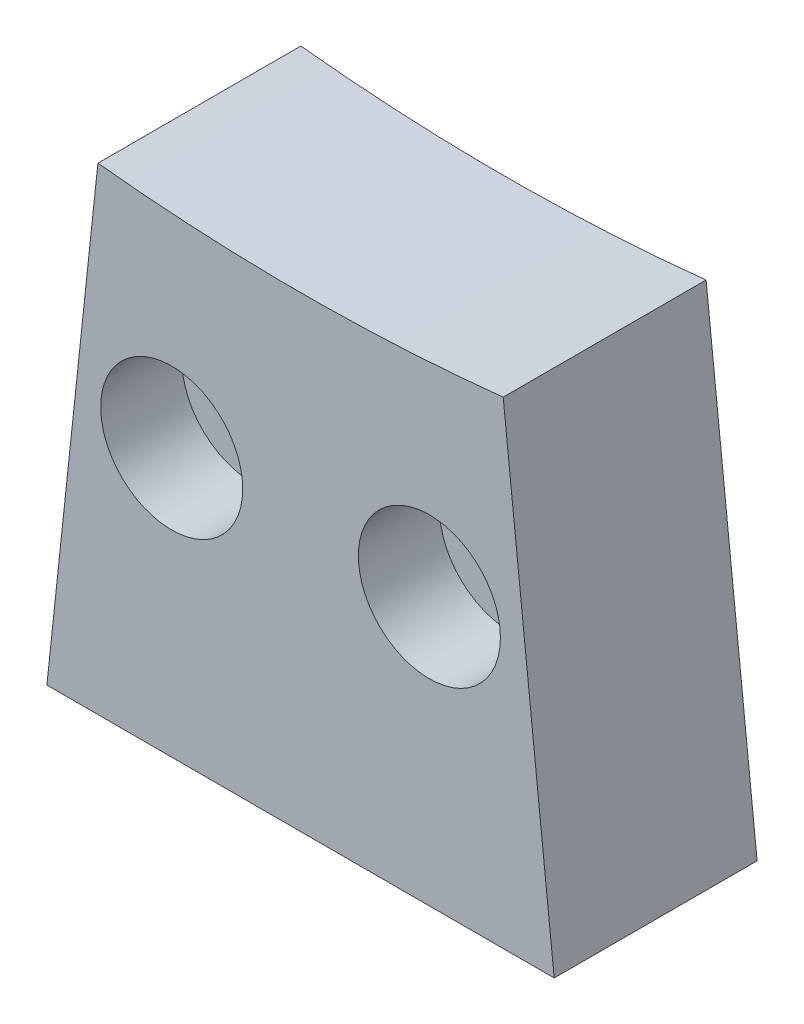
from build123d import *

# Parameters (mm, degrees)
BOSS_EXTRU_1_DEPTH      = 10
ESQUISSE2_R             = 1.025
ENL_V_MAT_EXTRU_1_DEPTH = 8
ENL_V_MAT_EXTRU_2_REACH = 120.09
ESQUISSE3_R             = 1.75
ESQUISSE4_R             = 3.5
ESQUISSE4_R_2           = 1.75
ENL_V_MAT_EXTRU_3_DEPTH = 4


with BuildPart() as part:
    # Esquisse1 → Boss.-Extru.1 (new body)
    with BuildSketch(Plane.XY):
        with BuildLine():
            Line((-12.5, -117), (12.5, -117))
            Line((12.5, -117), (9.985905815, -93.468078428))
            ThreePointArc((9.985905815, -93.468078428), (0, -94), (-9.985905815, -93.468078428))
            Line((-9.985905815, -93.468078428), (-12.5, -117))
        make_face()
    extrude(amount=BOSS_EXTRU_1_DEPTH)

    # Esquisse2 → Enlèv. mat.-Extru.1 (cut)
    with BuildSketch(Plane.XZ.offset(117)):
        with Locations((-4.75, 6)):
            Circle(ESQUISSE2_R)
        with Locations((4.75, 6)):
            Circle(ESQUISSE2_R)
    extrude(amount=-ENL_V_MAT_EXTRU_1_DEPTH, mode=Mode.SUBTRACT)

    # Esquisse3 → Enlèv. mat.-Extru.2 (cut, up to next)
    with BuildSketch(Plane.XY.offset(10), mode=Mode.PRIVATE) as enl_v_mat_extru_2_sk1:
        with Locations((-6.349048112, -103.806019036)):
            Circle(ESQUISSE3_R)
    enl_v_mat_extru_2_tool1 = extrude(enl_v_mat_extru_2_sk1.sketch, amount=-ENL_V_MAT_EXTRU_2_REACH, mode=Mode.PRIVATE) & part.part
    # Esquisse3 → Enlèv. mat.-Extru.2 (cut, up to next)
    with BuildSketch(Plane.XY.offset(10), mode=Mode.PRIVATE) as enl_v_mat_extru_2_sk2:
        with Locations((6.349048112, -103.806019036)):
            Circle(ESQUISSE3_R)
    enl_v_mat_extru_2_tool2 = extrude(enl_v_mat_extru_2_sk2.sketch, amount=-ENL_V_MAT_EXTRU_2_REACH, mode=Mode.PRIVATE) & part.part
    add(enl_v_mat_extru_2_tool1.solids().sort_by_distance((-6.349048, -103.806019, 10))[0], mode=Mode.SUBTRACT)
    add(enl_v_mat_extru_2_tool2.solids().sort_by_distance((6.349048, -103.806019, 10))[0], mode=Mode.SUBTRACT)

    # Esquisse4 → Enlèv. mat.-Extru.3 (cut)
    # profile 1 of 2: a face of its own
    with BuildSketch(Plane.XY.offset(10)):
        with Locations((6.349048112, -103.806019036)):
            Circle(ESQUISSE4_R)
        with Locations((6.349048112, -103.806019036)):
            Circle(ESQUISSE4_R_2, mode=Mode.SUBTRACT)
    # profile 2 of 2: a face of its own
    with BuildSketch(Plane.XY.offset(10)):
        with Locations((-6.349048112, -103.806019036)):
            Circle(ESQUISSE4_R)
    extrude(amount=-ENL_V_MAT_EXTRU_3_DEPTH, mode=Mode.SUBTRACT)


solid = part.part
